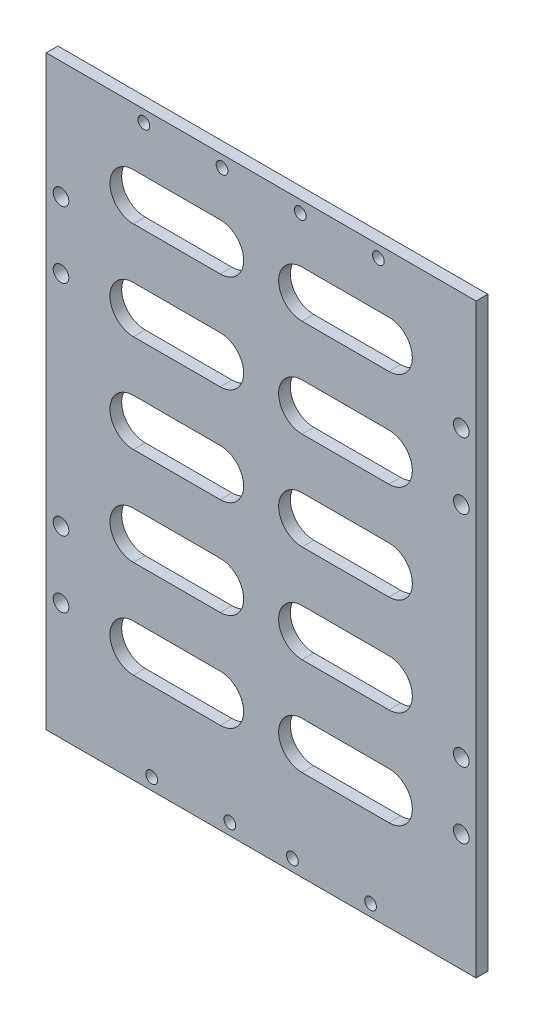
from build123d import *

# Parameters (mm, degrees)
SKETCH_1_W          = 110
SKETCH_1_H          = 150
EXTRUDE_1_DEPTH     = 3
SKETCH_2_R          = 1.5
CUT_EXTRUDE_1_DEPTH = 3
SKETCH_3_R          = 2
CUT_EXTRUDE_2_DEPTH = 187.034942954
SKETCH_4_R          = 1.5
CUT_EXTRUDE_3_DEPTH = 187.034942954
CUT_EXTRUDE_4_DEPTH = 10


with BuildPart() as part:
    # 草图1 → 凸台-拉伸1 (new body)
    with BuildSketch(Plane.XY):
        with Locations((55, 75)):
            Rectangle(SKETCH_1_W, SKETCH_1_H)
    extrude(amount=EXTRUDE_1_DEPTH)

    # 草图2 → 切除-拉伸1 (cut)
    with BuildSketch(Plane.XY.offset(3)):
        with Locations((45, 147)):
            Circle(SKETCH_2_R)
        with Locations((25, 147)):
            Circle(SKETCH_2_R)
        with Locations(Location((85, 147, 0), (0, 0, 180))):
            Circle(SKETCH_2_R)
        with Locations(Location((65, 147, 0), (0, 0, 180))):
            Circle(SKETCH_2_R)
    extrude(amount=-CUT_EXTRUDE_1_DEPTH, mode=Mode.SUBTRACT)

    # 草图3 → 切除-拉伸2 (cut, through all)
    with BuildSketch(Plane.XY.offset(3)):
        with Locations((3.8, 47)):
            Circle(SKETCH_3_R)
        with Locations((3.8, 30)):
            Circle(SKETCH_3_R)
        with Locations(Location((106.2, 30, 0), (0, 0, 180))):
            Circle(SKETCH_3_R)
        with Locations(Location((106.2, 47, 0), (0, 0, 180))):
            Circle(SKETCH_3_R)
        with Locations((106.2, 103)):
            Circle(SKETCH_3_R)
        with Locations((106.2, 120)):
            Circle(SKETCH_3_R)
        with Locations(Location((3.8, 120, 0), (0, 0, 180))):
            Circle(SKETCH_3_R)
        with Locations(Location((3.8, 103, 0), (0, 0, 180))):
            Circle(SKETCH_3_R)
    extrude(amount=-CUT_EXTRUDE_2_DEPTH, mode=Mode.SUBTRACT)

    # 草图4 → 切除-拉伸3 (cut, through all)
    with BuildSketch(Plane.XY.offset(3)):
        with Locations((63, 3)):
            Circle(SKETCH_4_R)
        with Locations((83, 3)):
            Circle(SKETCH_4_R)
        with Locations(Location((27, 3, 0), (0, 0, 180))):
            Circle(SKETCH_4_R)
        with Locations(Location((47, 3, 0), (0, 0, 180))):
            Circle(SKETCH_4_R)
    extrude(amount=-CUT_EXTRUDE_3_DEPTH, mode=Mode.SUBTRACT)

    # 草图5 → 切除-拉伸4 (cut)
    with BuildSketch(Plane.XY.offset(3)):
        with BuildLine():
            Line((22.319382164, 135.252792574), (44.525443001, 135.252792574))
            ThreePointArc((44.525443001, 135.252792574), (50.525443001, 129.252792574), (44.525443001, 123.252792574))
            Line((44.525443001, 123.252792574), (22.319382164, 123.252792574))
            ThreePointArc((22.319382164, 123.252792574), (16.319382164, 129.252792574), (22.319382164, 135.252792574))
        make_face()
        with BuildLine():
            Line((22.319382164, 110.252792574), (44.525443001, 110.252792574))
            ThreePointArc((44.525443001, 110.252792574), (50.525443001, 104.252792574), (44.525443001, 98.252792574))
            Line((44.525443001, 98.252792574), (22.319382164, 98.252792574))
            ThreePointArc((22.319382164, 98.252792574), (16.319382164, 104.252792574), (22.319382164, 110.252792574))
        make_face()
        with BuildLine():
            Line((22.319382164, 85.252792574), (44.525443001, 85.252792574))
            ThreePointArc((44.525443001, 85.252792574), (50.525443001, 79.252792574), (44.525443001, 73.252792574))
            Line((44.525443001, 73.252792574), (22.319382164, 73.252792574))
            ThreePointArc((22.319382164, 73.252792574), (16.319382164, 79.252792574), (22.319382164, 85.252792574))
        make_face()
        with BuildLine():
            Line((22.319382164, 60.252792574), (44.525443001, 60.252792574))
            ThreePointArc((44.525443001, 60.252792574), (50.525443001, 54.252792574), (44.525443001, 48.252792574))
            Line((44.525443001, 48.252792574), (22.319382164, 48.252792574))
            ThreePointArc((22.319382164, 48.252792574), (16.319382164, 54.252792574), (22.319382164, 60.252792574))
        make_face()
        with BuildLine():
            Line((22.319382164, 35.252792574), (44.525443001, 35.252792574))
            ThreePointArc((44.525443001, 35.252792574), (50.525443001, 29.252792574), (44.525443001, 23.252792574))
            Line((44.525443001, 23.252792574), (22.319382164, 23.252792574))
            ThreePointArc((22.319382164, 23.252792574), (16.319382164, 29.252792574), (22.319382164, 35.252792574))
        make_face()
        with BuildLine():
            Line((87.680617836, 35.252792574), (65.474556999, 35.252792574))
            ThreePointArc((65.474556999, 35.252792574), (59.474556999, 29.252792574), (65.474556999, 23.252792574))
            Line((65.474556999, 23.252792574), (87.680617836, 23.252792574))
            ThreePointArc((87.680617836, 23.252792574), (93.680617836, 29.252792574), (87.680617836, 35.252792574))
        make_face()
        with BuildLine():
            Line((87.680617836, 60.252792574), (65.474556999, 60.252792574))
            ThreePointArc((65.474556999, 60.252792574), (59.474556999, 54.252792574), (65.474556999, 48.252792574))
            Line((65.474556999, 48.252792574), (87.680617836, 48.252792574))
            ThreePointArc((87.680617836, 48.252792574), (93.680617836, 54.252792574), (87.680617836, 60.252792574))
        make_face()
        with BuildLine():
            Line((87.680617836, 85.252792574), (65.474556999, 85.252792574))
            ThreePointArc((65.474556999, 85.252792574), (59.474556999, 79.252792574), (65.474556999, 73.252792574))
            Line((65.474556999, 73.252792574), (87.680617836, 73.252792574))
            ThreePointArc((87.680617836, 73.252792574), (93.680617836, 79.252792574), (87.680617836, 85.252792574))
        make_face()
        with BuildLine():
            Line((87.680617836, 110.252792574), (65.474556999, 110.252792574))
            ThreePointArc((65.474556999, 110.252792574), (59.474556999, 104.252792574), (65.474556999, 98.252792574))
            Line((65.474556999, 98.252792574), (87.680617836, 98.252792574))
            ThreePointArc((87.680617836, 98.252792574), (93.680617836, 104.252792574), (87.680617836, 110.252792574))
        make_face()
        with BuildLine():
            Line((87.680617836, 135.252792574), (65.474556999, 135.252792574))
            ThreePointArc((65.474556999, 135.252792574), (59.474556999, 129.252792574), (65.474556999, 123.252792574))
            Line((65.474556999, 123.252792574), (87.680617836, 123.252792574))
            ThreePointArc((87.680617836, 123.252792574), (93.680617836, 129.252792574), (87.680617836, 135.252792574))
        make_face()
    extrude(amount=-CUT_EXTRUDE_4_DEPTH, mode=Mode.SUBTRACT)


solid = part.part
